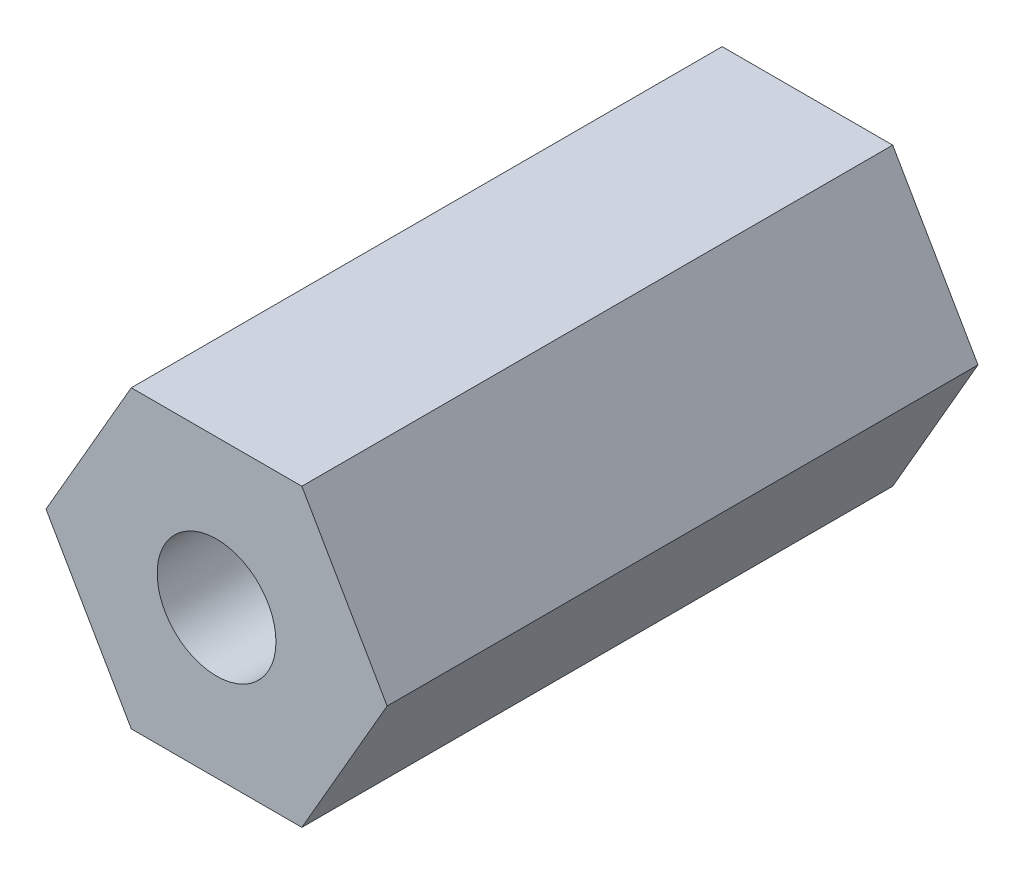
from build123d import *

# Parameters (mm, degrees)
SKETCH1_R           = 2.5527
BOSS_EXTRUDE1_DEPTH = 25.4


with BuildPart() as part:
    # Sketch1 → Boss-Extrude1 (new body)
    with BuildSketch(Plane.XY):
        Polygon((3.666174209, -6.35), (7.332348419, 0), (3.666174209, 6.35), (-3.666174209, 6.35), (-7.332348419, 0), (-3.666174209, -6.35), align=None)
        Circle(SKETCH1_R, mode=Mode.SUBTRACT)
    extrude(amount=BOSS_EXTRUDE1_DEPTH)


solid = part.part
